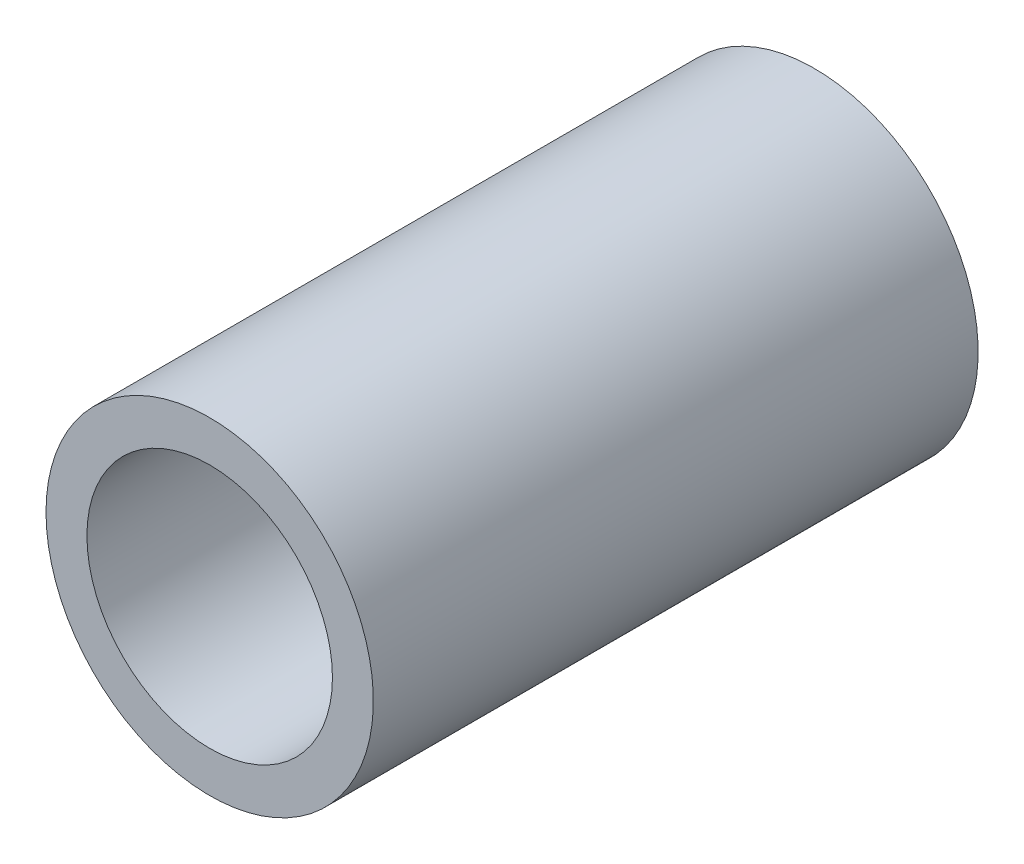
from build123d import *

# Parameters (mm, degrees)
SKETCH1_R           = 4
SKETCH1_R_2         = 3
BOSS_EXTRUDE1_DEPTH = 14.78


with BuildPart() as part:
    # Sketch1 → Boss-Extrude1 (new body)
    with BuildSketch(Plane.XY):
        with Locations(Location((0, 0, 0), (0, 0, 180))):
            Circle(SKETCH1_R)
        with Locations(Location((0, 0, 0), (0, 0, 180))):
            Circle(SKETCH1_R_2, mode=Mode.SUBTRACT)
    extrude(amount=BOSS_EXTRUDE1_DEPTH)


solid = part.part
